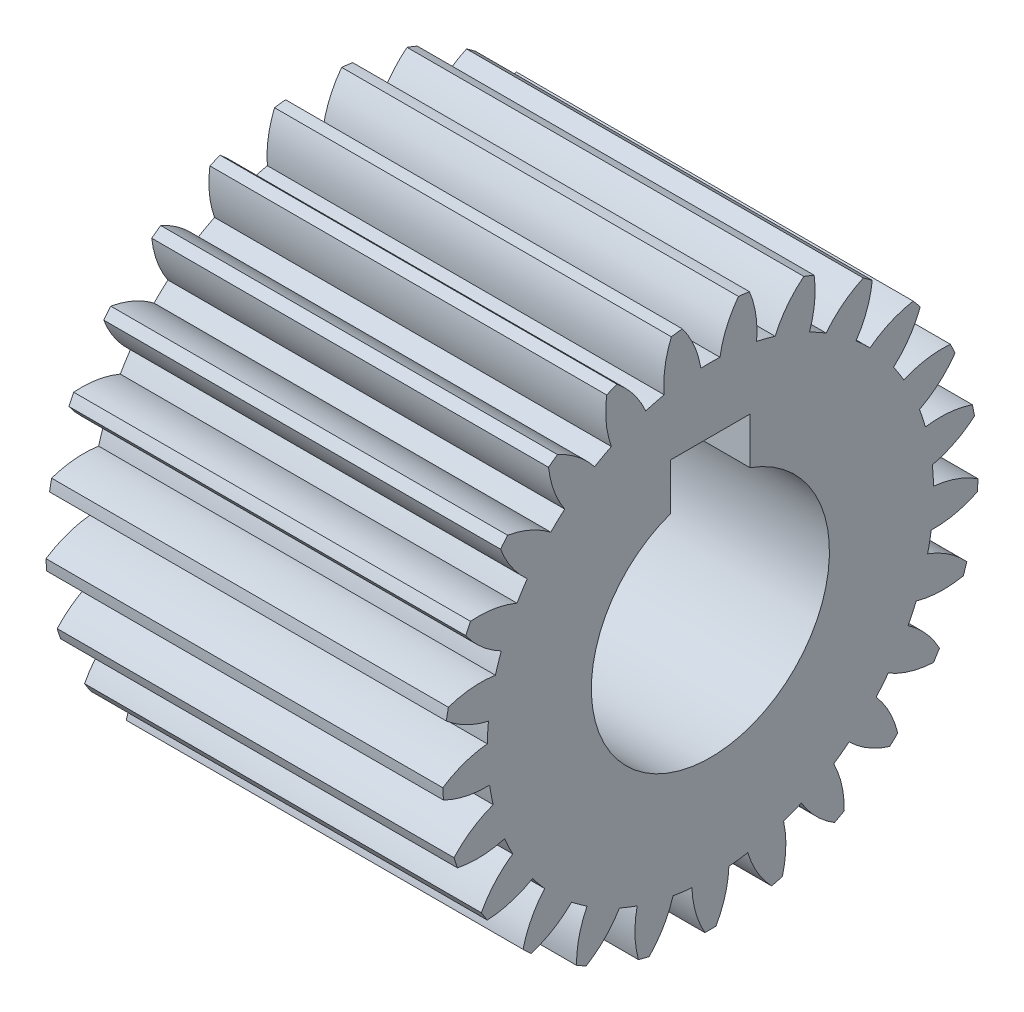
from build123d import *

# Parameters (mm, degrees)
BASPROSKE_W     = 10
BASPROSKE_H     = 6.75
TOOTHCUT_DEPTH  = 14.824796563
TEETHCUTS_COUNT = 25
TEETHCUTS_ANGLE = 345.6
BORSKE_R        = 3
BORE_DEPTH      = 50.0000508
KEYSKE_W        = 2
KEYSKE_H        = 4
KEYWAY_DEPTH    = 50.0000508


with BuildPart() as part:
    # BasProSke → Base-Revolve (revolve)
    with BuildSketch(Plane(origin=(0, 0, 0), x_dir=(1, 0, 0), z_dir=(0, 1, 0)), mode=Mode.PRIVATE) as base_revolve_sk:
        with Locations((5, 3.375)):
            Rectangle(BASPROSKE_W, BASPROSKE_H)
    revolve(base_revolve_sk.sketch.rotate(Axis((-10, 0, 0), (1, 0, 0)), 180), axis=Axis((-10, 0, 0), (1, 0, 0)))

    # TooCutSke → ToothCut (cut, through all)
    with BuildSketch(Plane(origin=(0, 0, 0), x_dir=(0, 0, -1), z_dir=(1, 0, 0))):
        with BuildLine():
            ThreePointArc((0.239962014, 5.618878378), (0, 5.624), (-0.239962014, 5.618878378))
            ThreePointArc((-0.239962014, 5.618878378), (-0.413411591, 6.207689485), (-0.725110563, 6.736487203))
            ThreePointArc((-0.725110563, 6.736487203), (0, 6.7754), (0.725110563, 6.736487203))
            ThreePointArc((0.725110563, 6.736487203), (0.413411591, 6.207689485), (0.239962014, 5.618878378))
        make_face()
    toothcut = extrude(amount=TOOTHCUT_DEPTH, mode=Mode.SUBTRACT)

    # TeethCuts: ToothCut ×25 about axis
    teethcuts_axis = Axis((-10, 0, 0), (1, 0, 0))
    for i in range(1, TEETHCUTS_COUNT):
        add(toothcut.rotate(teethcuts_axis, i * TEETHCUTS_ANGLE / (TEETHCUTS_COUNT - 1)), mode=Mode.SUBTRACT)

    # BorSke → Bore (cut, symmetric)
    with BuildSketch(Plane(origin=(0, 0, 0), x_dir=(0, 0, -1), z_dir=(1, 0, 0))):
        with Locations(Location((0, 0, 0), (0, 0, 180))):
            Circle(BORSKE_R)
    extrude(amount=BORE_DEPTH, both=True, mode=Mode.SUBTRACT)

    # KeySke → Keyway (cut, symmetric)
    with BuildSketch(Plane(origin=(0, 0, 0), x_dir=(0, 0, -1), z_dir=(1, 0, 0))):
        with Locations((0, 2)):
            Rectangle(KEYSKE_W, KEYSKE_H)
    extrude(amount=KEYWAY_DEPTH, both=True, mode=Mode.SUBTRACT)


solid = part.part
